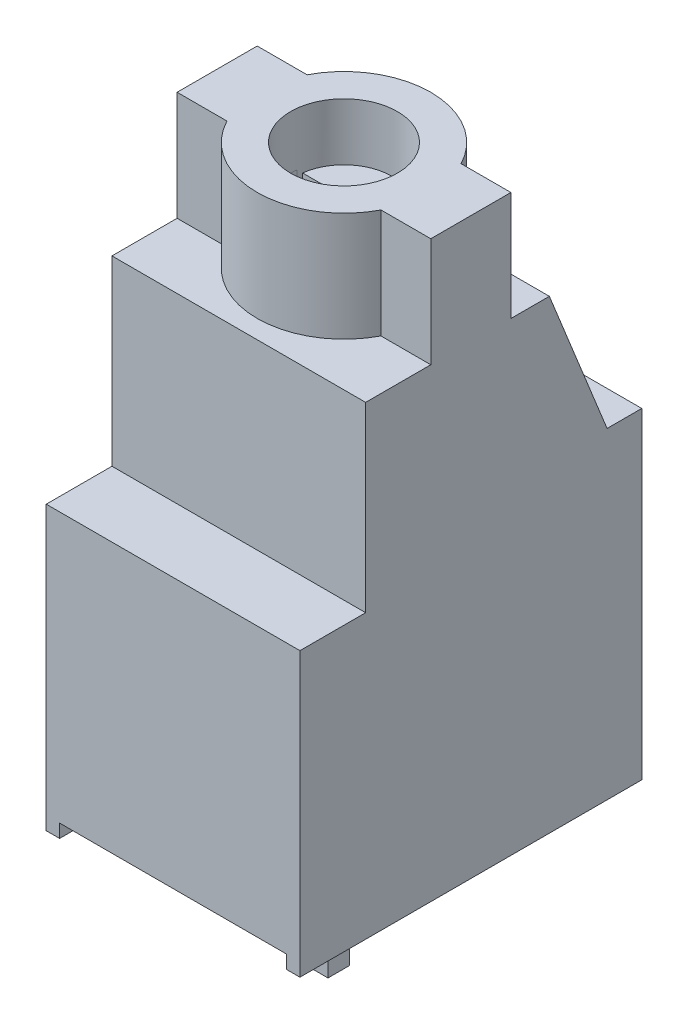
from build123d import *

# Parameters (mm, degrees)
EXTRUDE_1_DEPTH      = 4.75
EXTRUDE_1_DEPTH_BACK = 4.75
EXTRUDE_START        = -4.856555
SKETCH_3_R           = 3.25
EXTRUDE_2_DEPTH      = 4.856555
SKETCH_4_R           = 2
CUT_EXTRUDE_1_DEPTH  = 2
SKETCH_7_R           = 2
SKETCH_7_R_2         = 1.8
CUT_EXTRUDE_5_DEPTH  = 0.5
SKETCH_5_W           = 4
SKETCH_5_H           = 0.464054996
CUT_EXTRUDE_2_DEPTH  = 0.5
SKETCH_8_W           = 3.834533928
SKETCH_8_H           = 3.766589268
CUT_EXTRUDE_6_DEPTH  = 2
CHAMFER_1_SIZE       = 1
CHAMFER_1_SIZE2      = 1.732050808
SKETCH_9_W           = 8.5
SKETCH_9_H           = 12.8
CUT_EXTRUDE_7_DEPTH  = 0.5
SKETCH_10_W          = 1.2
SKETCH_10_H          = 0.8
EXTRUDE_4_DEPTH      = 5.2


with BuildPart() as part:
    # 草图2 → 凸台-拉伸1 (new, two sides: drawn at the far end of the back side and taken through both)
    with BuildSketch(Plane(origin=(0, 0, 0), x_dir=(0, 0, -1), z_dir=(1, 0, 0)).offset(-EXTRUDE_1_DEPTH_BACK)):
        Polygon((6.4, 0), (-6.4, 0), (-6.4, 10.591546325), (-3.93965691, 10.591546325), (-3.93965691, 17.413010672), (-1.5, 17.413010672), (-1.5, 21.5), (1.5, 21.5), (1.5, 17.413010672), (2.939959322, 17.413010672), (5.102008026, 12.046496925), (6.4, 12.046496925), align=None)
    extrude(amount=EXTRUDE_1_DEPTH + EXTRUDE_1_DEPTH_BACK)

    # 草图3 → 凸台-拉伸2 (add)
    with BuildSketch(Plane(origin=(0, 21.5, 0), x_dir=(1, 0, 0), z_dir=(0, 1, 0)).offset(EXTRUDE_START)):
        Circle(SKETCH_3_R)
    extrude(amount=EXTRUDE_2_DEPTH)

    # 草图4 → 切除-拉伸1 (cut)
    with BuildSketch(Plane(origin=(0, 21.5, 0), x_dir=(1, 0, 0), z_dir=(0, 1, 0))):
        with Locations(Location((0, 0, 0), (0, 0, 270))):
            Circle(SKETCH_4_R)
    extrude(amount=-CUT_EXTRUDE_1_DEPTH, mode=Mode.SUBTRACT)

    # 草图7 → 切除-拉伸5 (cut)
    with BuildSketch(Plane(origin=(0, 19.5, 0), x_dir=(1, 0, 0), z_dir=(0, 1, 0))):
        with Locations(Location((0, 0, 0), (0, 0, 270))):
            Circle(SKETCH_7_R)
        with Locations(Location((0, 0, 0), (0, 0, 270))):
            Circle(SKETCH_7_R_2, mode=Mode.SUBTRACT)
    extrude(amount=-CUT_EXTRUDE_5_DEPTH, mode=Mode.SUBTRACT)

    # 草图5 → 切除-拉伸2 (cut)
    with BuildSketch(Plane(origin=(0, 19.5, 0), x_dir=(1, 0, 0), z_dir=(0, 1, 0))):
        Rectangle(SKETCH_5_W, SKETCH_5_H)
    extrude(amount=-CUT_EXTRUDE_2_DEPTH, mode=Mode.SUBTRACT)

    # 草图8 → 切除-拉伸6 (cut)
    with BuildSketch(Plane(origin=(0, 0, -6.4), x_dir=(-1, 0, 0), z_dir=(0, 0, -1))):
        with Locations((0, 5.966845297)):
            Rectangle(SKETCH_8_W, SKETCH_8_H)
    extrude(amount=-CUT_EXTRUDE_6_DEPTH, mode=Mode.SUBTRACT)

    # 倒角1
    chamfer_1_edges = [part.edges().sort_by_distance(p)[0] for p in [
        (1.917266964, 5.966845297, -6.4),
        (0, 4.083550663, -6.4),
        (-1.917266964, 5.966845297, -6.4),
        (0, 7.850139931, -6.4),
    ]]
    chamfer_1_side = [part.faces().sort_by_distance(p)[0] for p in [
        (4.596582893, 6.023248462, -6.4),
    ]]
    chamfer(chamfer_1_edges, length=CHAMFER_1_SIZE, length2=CHAMFER_1_SIZE2, reference=chamfer_1_side[0])

    # 草图9 → 切除-拉伸7 (cut)
    with BuildSketch(Plane.XZ):
        Rectangle(SKETCH_9_W, SKETCH_9_H)
    extrude(amount=-CUT_EXTRUDE_7_DEPTH, mode=Mode.SUBTRACT)

    # 草图10 → 凸台-拉伸4 (add)
    with BuildSketch(Plane.XZ.offset(-0.5)):
        with Locations((0, 0.8)):
            Rectangle(SKETCH_10_W, SKETCH_10_H)
    extrude(amount=EXTRUDE_4_DEPTH)


solid = part.part
